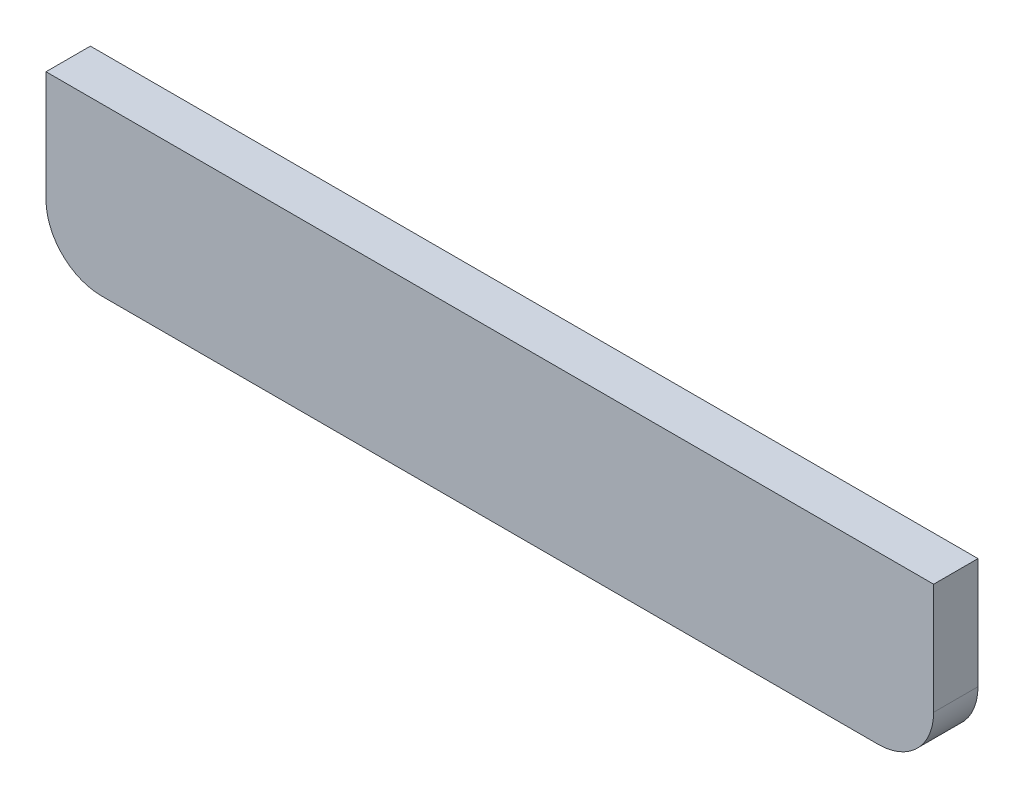
from build123d import *

# Parameters (mm, degrees)
SKETCH1_W           = 160
SKETCH1_H           = 30
BOSS_EXTRUDE1_DEPTH = 4
FILLET1_R           = 10


with BuildPart() as part:
    # Sketch1 → Boss-Extrude1 (new, symmetric)
    with BuildSketch(Plane.XY):
        Rectangle(SKETCH1_W, SKETCH1_H)
    extrude(amount=BOSS_EXTRUDE1_DEPTH, both=True)

    # Fillet1
    fillet1_edges = [part.edges().sort_by_distance(p)[0] for p in [
        (80, -15, 0),
        (-80, -15, 0),
    ]]
    fillet(fillet1_edges, radius=FILLET1_R)


solid = part.part
